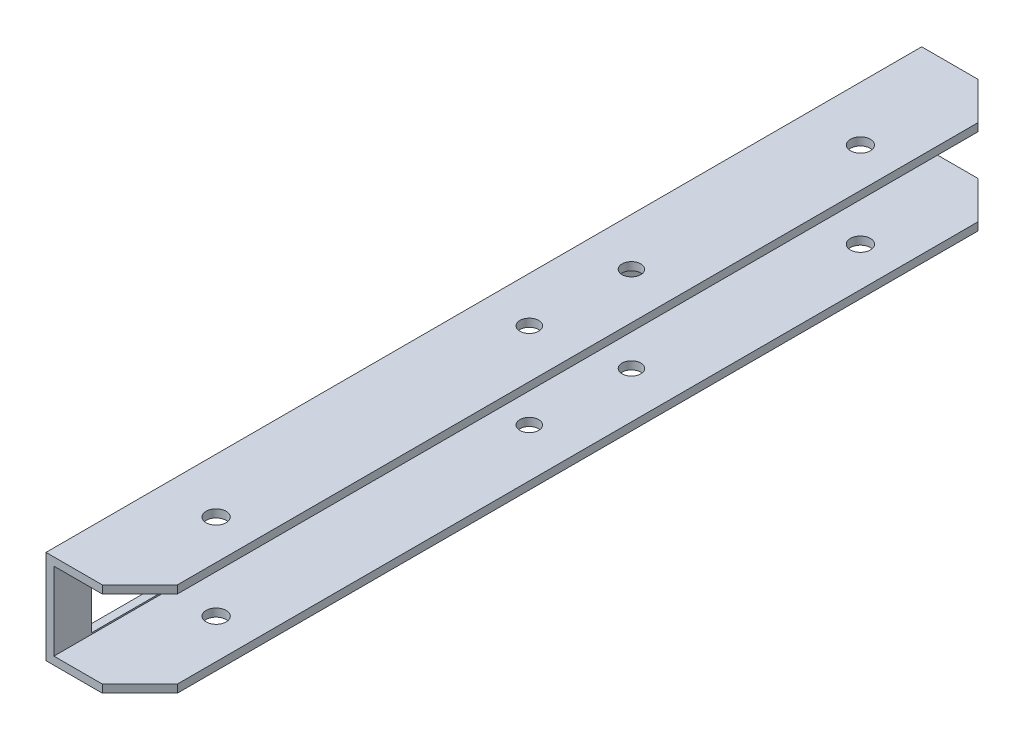
from build123d import *

# Parameters (mm, degrees)
BOSS_EXTRUDE1_DEPTH = 700
SKETCH3_W           = 125
SKETCH3_H           = 60
CUT_EXTRUDE1_DEPTH  = 706.00443261
CHAMFER1_SIZE       = 30
SKETCH4_R           = 8
CUT_EXTRUDE2_DEPTH  = 708.990112925
SKETCH5_R           = 7.5
CUT_EXTRUDE3_DEPTH  = 708.990112925
CHAMFER2_SIZE       = 3
FILLET1_R           = 3


with BuildPart() as part:
    # Sketch1 → Boss-Extrude1 (new body)
    with BuildSketch(Plane.XY):
        Polygon((0, -37.5), (0, 37.5), (75, 37.5), (75, 31.15), (6.35, 31.15), (6.35, -31.15), (75, -31.15), (75, -37.5), align=None)
    extrude(amount=BOSS_EXTRUDE1_DEPTH)

    # Sketch3 → Cut-Extrude1 (cut, through all)
    with BuildSketch(Plane.ZY):
        with Locations((92.5, 0)):
            Rectangle(SKETCH3_W, SKETCH3_H)
        with Locations((607.5, 0)):
            Rectangle(SKETCH3_W, SKETCH3_H)
        Polygon((400, 10.383333333), (373, 10.383333333), (373, 31.15), (327, 31.15), (307, 31.15), (307, 10.383333333), (300, 10.383333333), (270, 10.383333333), (270, -10.383333333), (300, -10.383333333), (327, -10.383333333), (327, -31.15), (373, -31.15), (393, -31.15), (393, -10.383333333), (400, -10.383333333), align=None)
    extrude(amount=-CUT_EXTRUDE1_DEPTH, mode=Mode.SUBTRACT)

    # Chamfer1
    chamfer1_edges = [part.edges().sort_by_distance(p)[0] for p in [
        (75, -34.325, 0),
        (75, 34.325, 700),
        (75, -34.325, 700),
        (75, 34.325, 0),
    ]]
    chamfer(chamfer1_edges, length=CHAMFER1_SIZE)

    # Sketch4 → Cut-Extrude2 (cut, through all)
    with BuildSketch(Plane(origin=(0, 37.5, 0), x_dir=(1, 0, 0), z_dir=(0, 1, 0))):
        with Locations(Location((43.5, -607.5, 0), (0, 0, 270))):
            Circle(SKETCH4_R)
        with Locations(Location((43.5, -92.5, 0), (0, 0, 270))):
            Circle(SKETCH4_R)
    extrude(amount=-CUT_EXTRUDE2_DEPTH, mode=Mode.SUBTRACT)

    # Sketch5 → Cut-Extrude3 (cut, through all)
    with BuildSketch(Plane.XZ.offset(37.5)):
        with Locations(Location((38, 270.017579968, 0), (0, 0, 270))):
            Circle(SKETCH5_R)
        with Locations(Location((36.322953254, 350, 0), (0, 0, 270))):
            Circle(SKETCH5_R)
    extrude(amount=-CUT_EXTRUDE3_DEPTH, mode=Mode.SUBTRACT)

    # Chamfer2
    chamfer2_edges = [part.edges().sort_by_distance(p)[0] for p in [
        (6.35, 0, 155),
        (6.35, 0, 545),
        (6.35, -20.766666667, 327),
        (6.35, 0, 270),
        (6.35, 20.766666667, 373),
        (0, -20.766666667, 393),
        (0, 20.766666667, 307),
    ]]
    chamfer(chamfer2_edges, length=CHAMFER2_SIZE)

    # Fillet1
    fillet1_edges = [part.edges().sort_by_distance(p)[0] for p in [
        (1.675, 10.383333333, 270),
        (1.675, -10.383333333, 270),
        (1.675, 31.15, 373),
        (1.675, -31.15, 327),
        (4.675, -31.15, 393),
        (4.675, 31.15, 307),
        (3.175, 10.383333333, 400),
        (3.175, -10.383333333, 400),
    ]]
    fillet(fillet1_edges, radius=FILLET1_R)


solid = part.part
